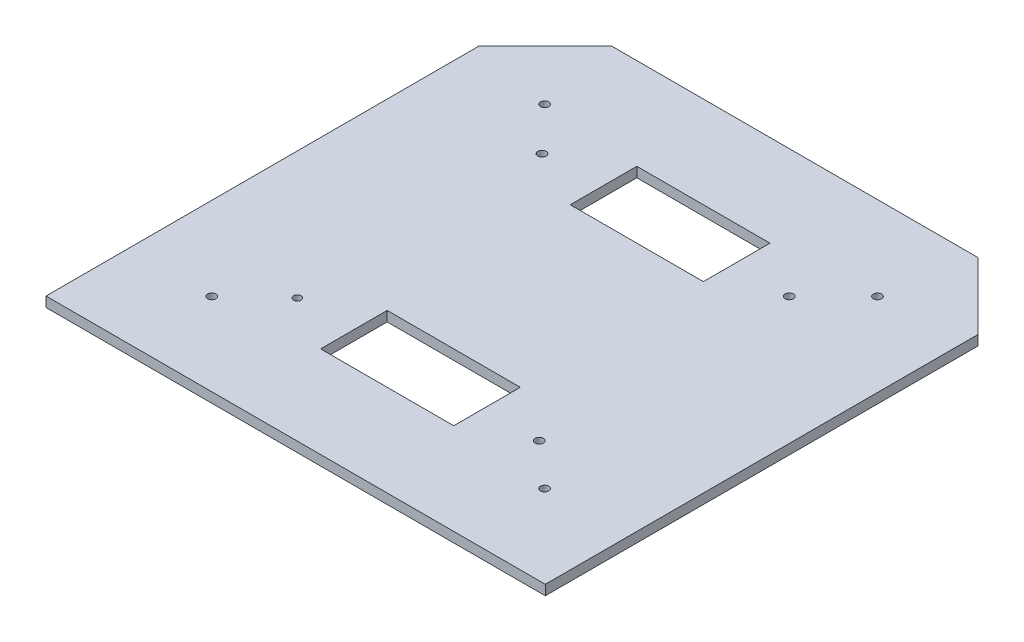
from build123d import *

# Parameters (mm, degrees)
ESQUISSE1_W              = 80
ESQUISSE1_H              = 40
BOSS_EXTRU_1_DEPTH       = 6
ESQUISSE9_R              = 2.5
ESQUISSE9_R_2            = 2.3
ENL_V_MAT_EXTRU_12_DEPTH = 35


with BuildPart() as part:
    # Esquisse1 → Boss.-Extru.1 (new body)
    with BuildSketch(Plane(origin=(0, 0, 0), x_dir=(1, 0, 0), z_dir=(0, 1, 0))):
        Polygon((-150, 0), (-150, 260), (-110, 300), (110, 300), (150, 260), (150, 0), align=None)
        with Locations((0, 75)):
            Rectangle(ESQUISSE1_W, ESQUISSE1_H, mode=Mode.SUBTRACT)
        with Locations((0, 225)):
            Rectangle(ESQUISSE1_W, ESQUISSE1_H, mode=Mode.SUBTRACT)
    extrude(amount=BOSS_EXTRU_1_DEPTH)

    # Esquisse9 → Enlèv. mat.-Extru.12 (cut)
    with BuildSketch(Plane(origin=(0, 6, 0), x_dir=(1, 0, 0), z_dir=(0, 1, 0))):
        with Locations(Location((-100, 249.602322281, 0), (0, 0, 270))):
            Circle(ESQUISSE9_R)
        with Locations(Location((-75.031111773, 223.085817986, 0), (0, 0, 270))):
            Circle(ESQUISSE9_R)
        with Locations(Location((73.483495706, 223.085817986, 0), (0, 0, 270))):
            Circle(ESQUISSE9_R)
        with Locations(Location((100, 249.602322281, 0), (0, 0, 270))):
            Circle(ESQUISSE9_R)
        with Locations(Location((73.483495706, 72.865212221, 0), (0, 0, 270))):
            Circle(ESQUISSE9_R)
        with Locations(Location((100, 49.602322281, 0), (0, 0, 270))):
            Circle(ESQUISSE9_R)
        with Locations(Location((-73.489446443, 74.470995042, 0), (0, 0, 270))):
            Circle(ESQUISSE9_R_2)
        with Locations(Location((-100, 49.602322281, 0), (0, 0, 270))):
            Circle(ESQUISSE9_R)
    extrude(amount=-ENL_V_MAT_EXTRU_12_DEPTH, mode=Mode.SUBTRACT)


solid = part.part
